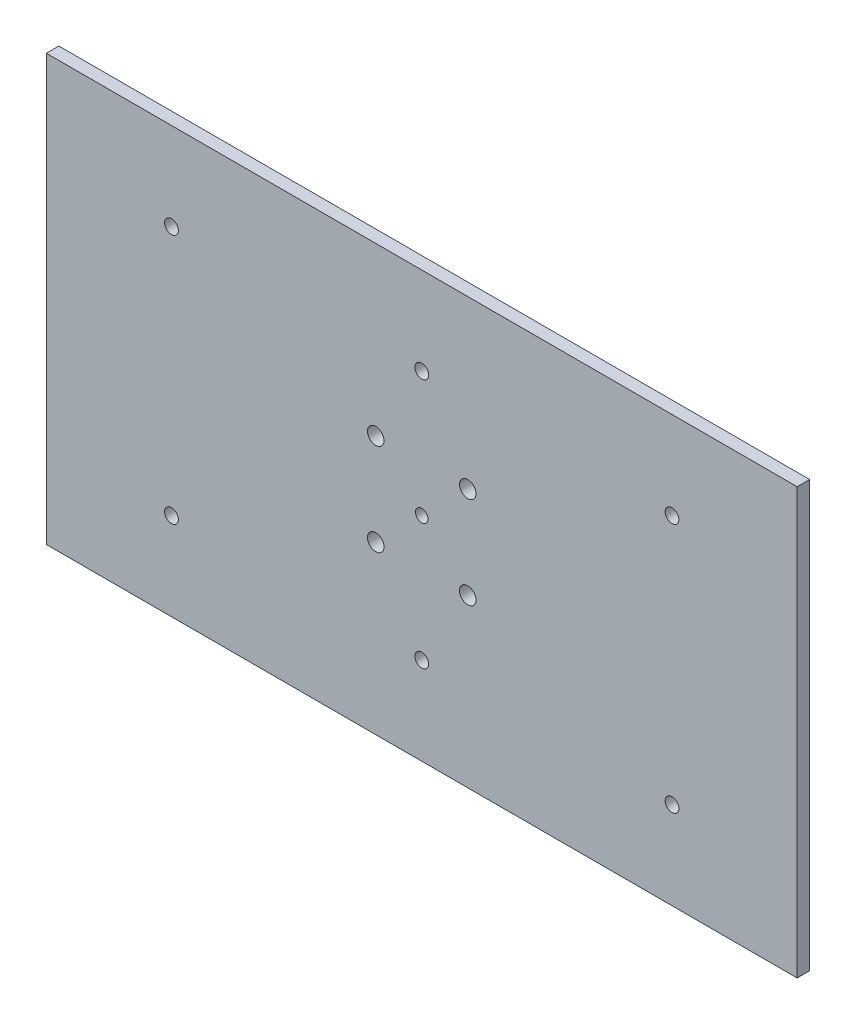
from build123d import *

# Parameters (mm, degrees)
SKETCH_1_W          = 300
SKETCH_1_H          = 250
SKETCH_1_R          = 3.3
SKETCH_1_R_2        = 2.5
EXTRUDE_1_DEPTH     = 5
SKETCH_2_R          = 2.75
CUT_EXTRUDE_1_DEPTH = 196.320249846
SKETCH_3_W          = 300
SKETCH_3_H          = 40
CUT_EXTRUDE_2_DEPTH = 196.320249846


with BuildPart() as part:
    # 草图1 → 凸台-拉伸1 (new body)
    with BuildSketch(Plane.XY):
        Rectangle(SKETCH_1_W, SKETCH_1_H)
        with Locations((-18.384776311, 18.384776311)):
            Circle(SKETCH_1_R, mode=Mode.SUBTRACT)
        with Locations(Location((18.384776311, 18.384776311, 0), (0, 0, 180))):
            Circle(SKETCH_1_R, mode=Mode.SUBTRACT)
        with Locations((18.384776311, -18.384776311)):
            Circle(SKETCH_1_R, mode=Mode.SUBTRACT)
        with Locations(Location((-18.384776311, -18.384776311, 0), (0, 0, 180))):
            Circle(SKETCH_1_R, mode=Mode.SUBTRACT)
        Circle(SKETCH_1_R_2, mode=Mode.SUBTRACT)
    extrude(amount=EXTRUDE_1_DEPTH)

    # 草图2 → 切除-拉伸1 (cut, through all)
    with BuildSketch(Plane.XY.offset(5)):
        with Locations((-100, 50)):
            Circle(SKETCH_2_R)
        with Locations((0, 50)):
            Circle(SKETCH_2_R)
        with Locations((100, 50)):
            Circle(SKETCH_2_R)
        with Locations((100, -50)):
            Circle(SKETCH_2_R)
        with Locations((0, -50)):
            Circle(SKETCH_2_R)
        with Locations((-100, -50)):
            Circle(SKETCH_2_R)
    extrude(amount=-CUT_EXTRUDE_1_DEPTH, mode=Mode.SUBTRACT)

    # 草图3 → 切除-拉伸2 (cut, through all)
    with BuildSketch(Plane.XY.offset(5)):
        with Locations((0, 105)):
            Rectangle(SKETCH_3_W, SKETCH_3_H)
        with Locations((0, -105)):
            Rectangle(SKETCH_3_W, SKETCH_3_H)
    extrude(amount=-CUT_EXTRUDE_2_DEPTH, mode=Mode.SUBTRACT)


solid = part.part
